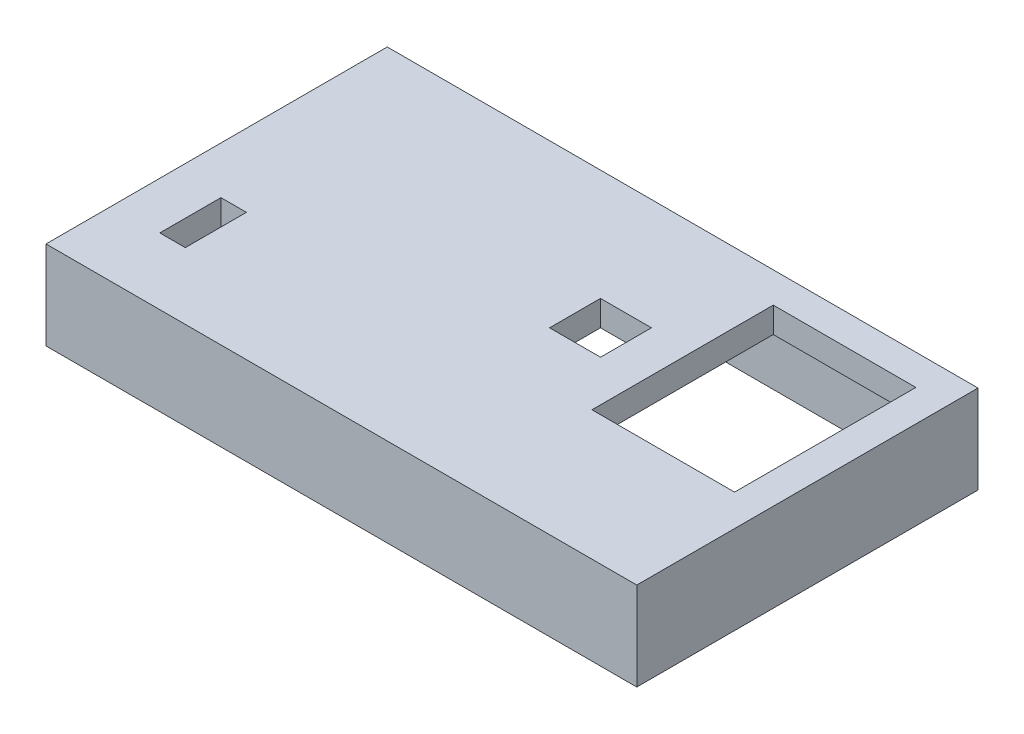
from build123d import *

# Parameters (mm, degrees)
SKETCH1_W           = 116
SKETCH1_H           = 67
BOSS_EXTRUDE1_DEPTH = 5
SKETCH2_W           = 116
SKETCH2_H           = 67
SKETCH2_W_2         = 110
SKETCH2_H_2         = 61
BOSS_EXTRUDE2_DEPTH = 12.35
SKETCH3_W           = 28
SKETCH3_H           = 35.6
CUT_EXTRUDE1_DEPTH  = 135.527032599
SKETCH4_W           = 10
SKETCH4_H           = 10
CUT_EXTRUDE2_DEPTH  = 135.527032599
SKETCH5_W           = 5
SKETCH5_H           = 12
CUT_EXTRUDE3_DEPTH  = 135.527032599


with BuildPart() as part:
    # Sketch1 → Boss-Extrude1 (new body)
    with BuildSketch(Plane(origin=(0, 0, 0), x_dir=(1, 0, 0), z_dir=(0, 1, 0))):
        with Locations((58, 33.5)):
            Rectangle(SKETCH1_W, SKETCH1_H)
    extrude(amount=BOSS_EXTRUDE1_DEPTH)

    # Sketch2 → Boss-Extrude2 (add)
    with BuildSketch(Plane.XZ):
        with Locations((58, -33.5)):
            Rectangle(SKETCH2_W, SKETCH2_H)
        with Locations((58, -33.5)):
            Rectangle(SKETCH2_W_2, SKETCH2_H_2, mode=Mode.SUBTRACT)
    extrude(amount=BOSS_EXTRUDE2_DEPTH)

    # Sketch3 → Cut-Extrude1 (cut, through all)
    with BuildSketch(Plane.XZ):
        with Locations((95.8, -43.2)):
            Rectangle(SKETCH3_W, SKETCH3_H)
    extrude(amount=-CUT_EXTRUDE1_DEPTH, mode=Mode.SUBTRACT)

    # Sketch4 → Cut-Extrude2 (cut, through all)
    with BuildSketch(Plane.XZ):
        with Locations((68.7, -40.18)):
            Rectangle(SKETCH4_W, SKETCH4_H)
    extrude(amount=-CUT_EXTRUDE2_DEPTH, mode=Mode.SUBTRACT)

    # Sketch5 → Cut-Extrude3 (cut, through all)
    with BuildSketch(Plane.XZ):
        with Locations((11.8, -19.05)):
            Rectangle(SKETCH5_W, SKETCH5_H)
    extrude(amount=-CUT_EXTRUDE3_DEPTH, mode=Mode.SUBTRACT)


solid = part.part
